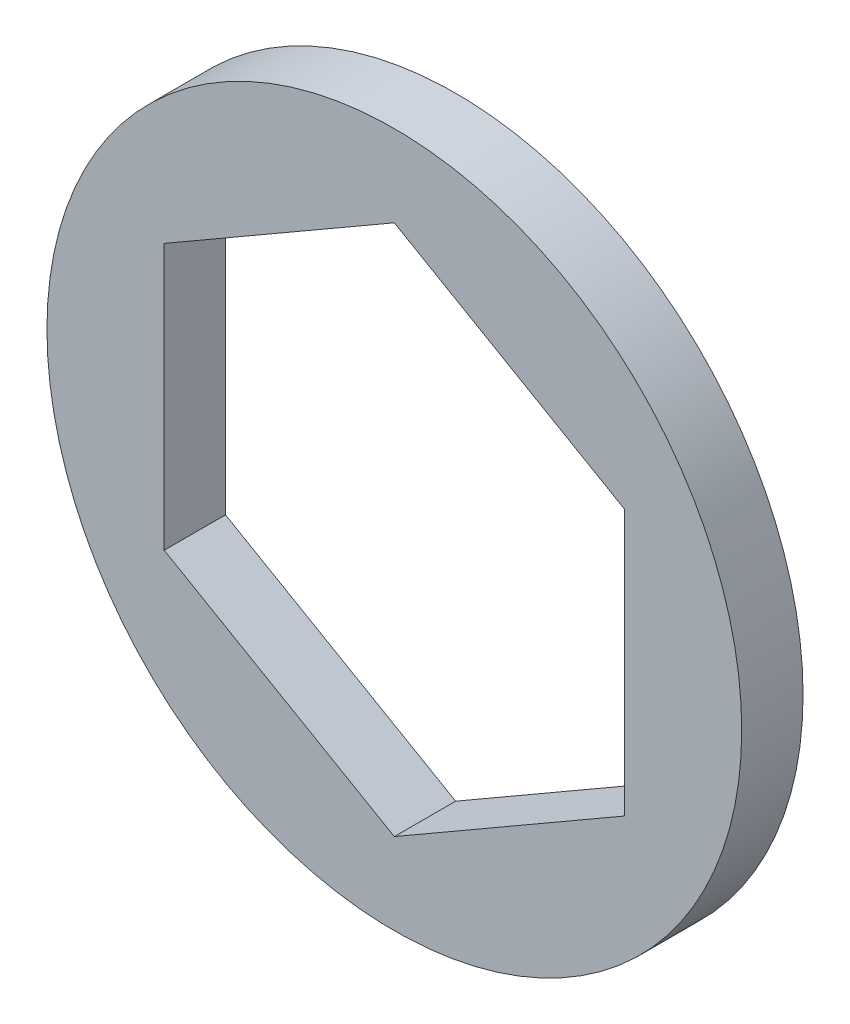
from build123d import *

# Parameters (mm, degrees)
SKETCH1_R           = 10.16
BOSS_EXTRUDE1_DEPTH = 1.793500096


with BuildPart() as part:
    # Sketch1 → Boss-Extrude1 (new body)
    with BuildSketch(Plane.XY):
        Circle(SKETCH1_R)
        Polygon((6.731, 3.886144662), (0, 7.772289324), (-6.731, 3.886144662), (-6.731, -3.886144662), (0, -7.772289324), (6.731, -3.886144662), align=None, mode=Mode.SUBTRACT)
    extrude(amount=BOSS_EXTRUDE1_DEPTH)


solid = part.part
